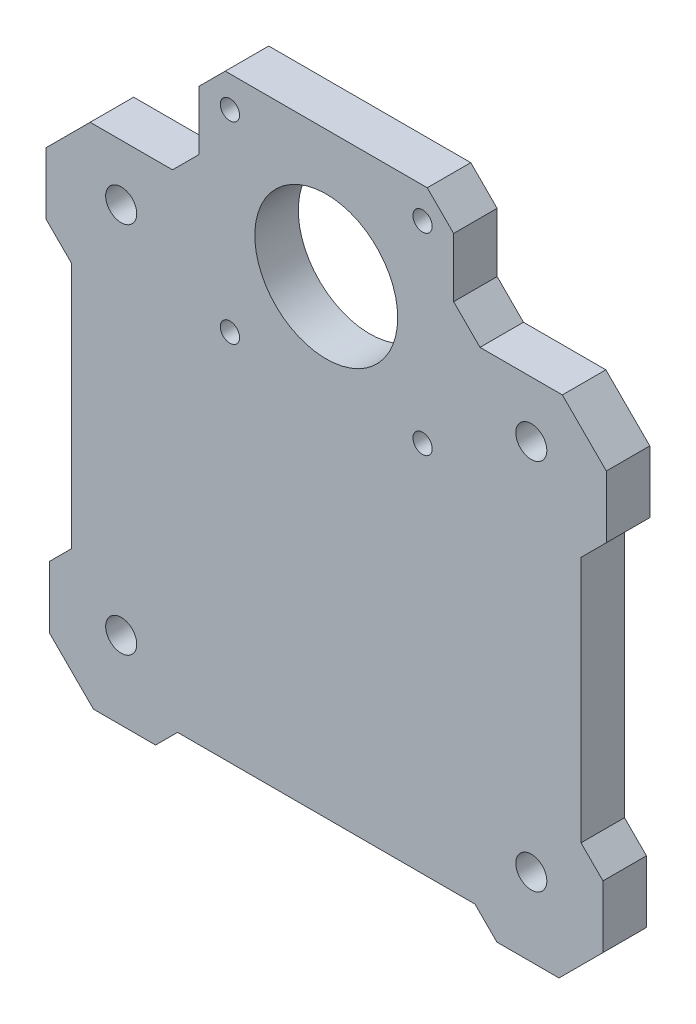
from build123d import *

# Parameters (mm, degrees)
SALIENTE_EXTRUIR5_DEPTH = 7
CROQUIS5_R              = 1.55
CORTAR_EXTRUIR1_DEPTH   = 71.562029449
SALIENTE_EXTRUIR7_DEPTH = 7
CORTAR_EXTRUIR2_DEPTH   = 74.002747576


with BuildPart() as part:
    # Croquis1 → Saliente-Extruir5 (new body)
    with BuildSketch(Plane.XY):
        with BuildLine():
            Line((-20.5, 30), (-30.5, 30))
            ThreePointArc((-30.5, 30), (-31.232233047, 28.232233047), (-33, 27.5))
            Line((-33, 27.5), (-33, -27.5))
            ThreePointArc((-33, -27.5), (-31.232233047, -28.232233047), (-30.5, -30))
            Line((-30.5, -30), (30.5, -30))
            ThreePointArc((30.5, -30), (31.232233047, -28.232233047), (33, -27.5))
            Line((33, -27.5), (33, 27.5))
            ThreePointArc((33, 27.5), (31.232233047, 28.232233047), (30.5, 30))
            Line((30.5, 30), (20.5, 30))
            Line((20.5, 30), (20.5, 16))
            Line((20.5, 16), (-20.5, 16))
            Line((-20.5, 16), (-20.5, 30))
        make_face()
        with BuildLine():
            Line((-9.486832981, 30), (-20.5, 30))
            Line((-20.5, 30), (-20.5, 16))
            Line((-20.5, 16), (20.5, 16))
            Line((20.5, 16), (20.5, 30))
            Line((20.5, 30), (9.486832981, 30))
            ThreePointArc((9.486832981, 30), (0, 25), (-9.486832981, 30))
        make_face()
        with BuildLine():
            ThreePointArc((-33, 27.5), (-34.767766953, 31.767766953), (-30.5, 30))
            Line((-30.5, 30), (-20.5, 30))
            Line((-20.5, 30), (-20.5, 39))
            Line((-20.5, 39), (-41, 39))
            Line((-41, 39), (-41, -39))
            Line((-41, -39), (41, -39))
            Line((41, -39), (41, 39))
            Line((41, 39), (20.5, 39))
            Line((20.5, 39), (20.5, 30))
            Line((20.5, 30), (30.5, 30))
            ThreePointArc((30.5, 30), (33, 32.5), (35.5, 30))
            ThreePointArc((35.5, 30), (34.767766953, 28.232233047), (33, 27.5))
            Line((33, 27.5), (33, -27.5))
            ThreePointArc((33, -27.5), (34.767766953, -28.232233047), (35.5, -30))
            ThreePointArc((35.5, -30), (33, -32.5), (30.5, -30))
            Line((30.5, -30), (-30.5, -30))
            ThreePointArc((-30.5, -30), (-34.767766953, -31.767766953), (-33, -27.5))
            Line((-33, -27.5), (-33, 27.5))
        make_face()
        with BuildLine():
            Line((-20.5, 57), (-20.5, 39))
            Line((-20.5, 39), (-11.22497216, 39))
            ThreePointArc((-11.22497216, 39), (0, 48), (11.22497216, 39))
            Line((11.22497216, 39), (20.5, 39))
            Line((20.5, 39), (20.5, 57))
            Line((20.5, 57), (-20.5, 57))
        make_face()
        with BuildLine():
            Line((-20.5, 39), (-20.5, 30))
            Line((-20.5, 30), (-9.486832981, 30))
            ThreePointArc((-9.486832981, 30), (-11.291355899, 34.319339102), (-11.22497216, 39))
            Line((-11.22497216, 39), (-20.5, 39))
        make_face()
        with BuildLine():
            ThreePointArc((11.5, 36.5), (10.985185007, 33.097690437), (9.486832981, 30))
            Line((9.486832981, 30), (20.5, 30))
            Line((20.5, 30), (20.5, 39))
            Line((20.5, 39), (11.22497216, 39))
            ThreePointArc((11.22497216, 39), (11.431036258, 37.757541283), (11.5, 36.5))
        make_face()
    extrude(amount=SALIENTE_EXTRUIR5_DEPTH)

    # Croquis5 → Cortar-Extruir1 (cut, through all)
    with BuildSketch(Plane.XY.offset(7)):
        with Locations((-15.5, 52)):
            Circle(CROQUIS5_R)
        with Locations((15.5, 52)):
            Circle(CROQUIS5_R)
        with Locations((15.5, 21)):
            Circle(CROQUIS5_R)
        with Locations((-15.5, 21)):
            Circle(CROQUIS5_R)
    extrude(amount=-CORTAR_EXTRUIR1_DEPTH, mode=Mode.SUBTRACT)

    # Croquis6 → Saliente-Extruir7 (add, through all)
    with BuildSketch(Plane.XY.offset(7)):
        Polygon((-41, 17.857864376), (-41, 36), (-45.071067812, 31.928932188), (-45.071067812, 21.928932188), align=None)
        Polygon((-20.5, 43.242640687), (-24.742640687, 39), (-20.5, 39), align=None)
        Polygon((20.5, 43.242640687), (20.5, 39), (24.742640687, 39), align=None)
        Polygon((45.071067812, 31.928932188), (41, 36), (41, 17.857864376), (45.071067812, 21.928932188), align=None)
        Polygon((41, -21.928932188), (41, -39), (44.535533906, -35.464466094), (44.535533906, -25.464466094), align=None)
        Polygon((41, -39), (23.928932188, -39), (27.464466094, -42.535533906), (37.464466094, -42.535533906), align=None)
        Polygon((-41, -39), (-41, -21.928932188), (-44.535533906, -25.464466094), (-44.535533906, -35.464466094), align=None)
        Polygon((-23.928932188, -39), (-41, -39), (-37.464466094, -42.535533906), (-27.464466094, -42.535533906), align=None)
    extrude(amount=-SALIENTE_EXTRUIR7_DEPTH)

    # Croquis7 → Cortar-Extruir2 (cut, through all)
    with BuildSketch(Plane.XY.offset(7)):
        Polygon((-20.5, 52.757359313), (-16.257359313, 57), (-20.5, 57), align=None)
        Polygon((20.5, 57), (16.257359313, 57), (20.5, 52.757359313), align=None)
        Polygon((-41, 39), (-41, 36), (-38, 39), align=None)
        Polygon((38, 39), (41, 36), (41, 39), align=None)
    extrude(amount=-CORTAR_EXTRUIR2_DEPTH, mode=Mode.SUBTRACT)


solid = part.part
